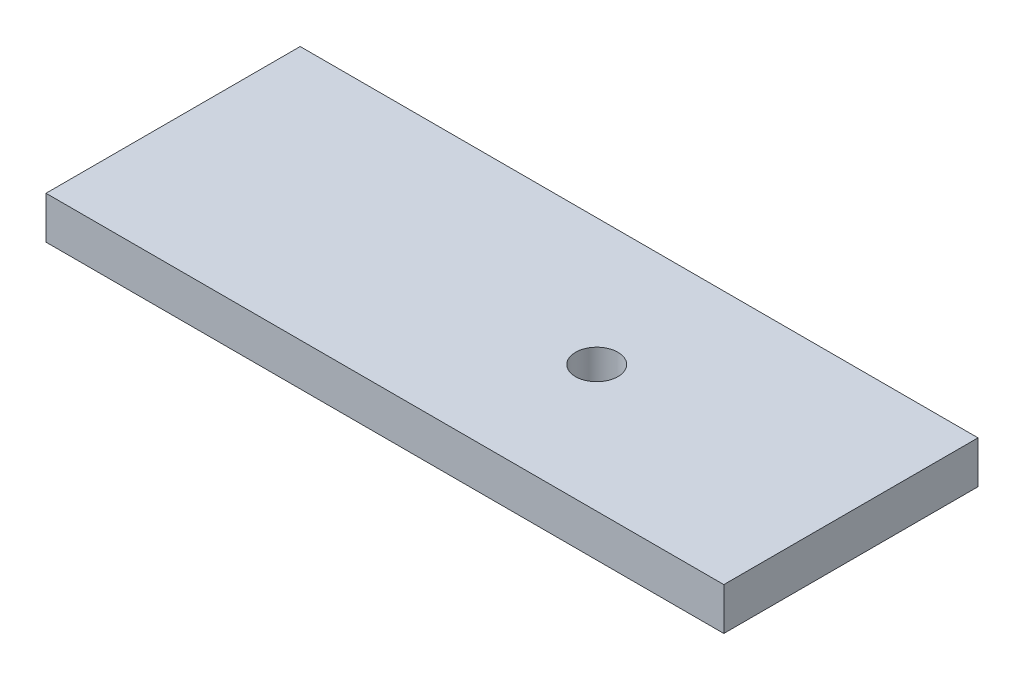
from build123d import *

# Parameters (mm, degrees)
SKETCH1_W           = 50.8
SKETCH1_H           = 19.05
BOSS_EXTRUDE1_DEPTH = 3.175
SKETCH2_R           = 1.190625
CUT_EXTRUDE1_DEPTH  = 9.525
SKETCH3_R           = 1.5875
CUT_EXTRUDE2_DEPTH  = 55.34724579


with BuildPart() as part:
    # Sketch1 → Boss-Extrude1 (new body)
    with BuildSketch(Plane(origin=(0, 0, 0), x_dir=(1, 0, 0), z_dir=(0, 1, 0))):
        with Locations((25.4, 9.525)):
            Rectangle(SKETCH1_W, SKETCH1_H)
    extrude(amount=BOSS_EXTRUDE1_DEPTH)

    # Sketch2 → Cut-Extrude1 (cut)
    with BuildSketch(Plane.ZY):
        with Locations((-5.08, 1.5875)):
            Circle(SKETCH2_R)
        with Locations((-13.97, 1.5875)):
            Circle(SKETCH2_R)
    extrude(amount=-CUT_EXTRUDE1_DEPTH, mode=Mode.SUBTRACT)

    # Sketch3 → Cut-Extrude2 (cut, through all)
    with BuildSketch(Plane(origin=(0, 3.175, 0), x_dir=(1, 0, 0), z_dir=(0, 1, 0))):
        with Locations(Location((31.75, 9.525, 0), (0, 0, 270))):
            Circle(SKETCH3_R)
    extrude(amount=-CUT_EXTRUDE2_DEPTH, mode=Mode.SUBTRACT)


solid = part.part
